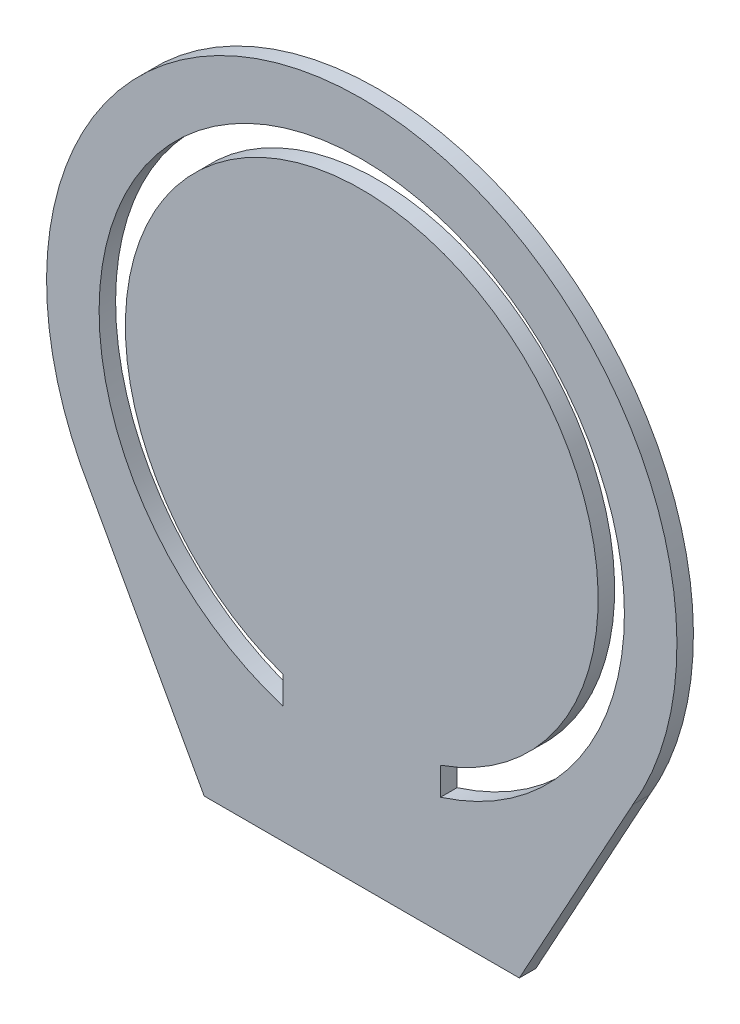
from build123d import *

# Parameters (mm, degrees)
ESBO_O1_R           = 30
ESBO_O1_R_2         = 25
BOSS_EXTRUDE1_DEPTH = 1.57
BOSS_EXTRUDE2_START = -1.57
BOSS_EXTRUDE2_DEPTH = 1.57
BOSS_EXTRUDE3_DEPTH = 1.57
BOSS_EXTRUDE4_START = -1.57
SKETCH4_R           = 22.5
BOSS_EXTRUDE4_DEPTH = 1.57


with BuildPart() as part:
    # Esboço1 → Boss-Extrude1 (new body)
    with BuildSketch(Plane.XY):
        Circle(ESBO_O1_R)
        Circle(ESBO_O1_R_2, mode=Mode.SUBTRACT)
    extrude(amount=BOSS_EXTRUDE1_DEPTH)

    # Sketch1 → Boss-Extrude2 (add)
    with BuildSketch(Plane.XY.offset(1.57).offset(BOSS_EXTRUDE2_START)):
        with BuildLine():
            Line((-25.800536663, -15.307916512), (-15, -35))
            Line((-15, -35), (-15, -25.980762114))
            ThreePointArc((-15, -25.980762114), (-21.086686707, -21.338970071), (-25.800536663, -15.307916512))
        make_face()
        with BuildLine():
            Line((-15, -35), (0, -35))
            Line((0, -35), (0, -30))
            ThreePointArc((0, -30), (-7.764571353, -28.977774789), (-15, -25.980762114))
            Line((-15, -25.980762114), (-15, -35))
        make_face()
        with BuildLine():
            Line((0, -35), (15, -35))
            Line((15, -35), (15, -25.980762114))
            ThreePointArc((15, -25.980762114), (7.764571353, -28.977774789), (0, -30))
            Line((0, -30), (0, -35))
        make_face()
        with BuildLine():
            Line((15, -25.980762114), (15, -35))
            Line((15, -35), (25.800536663, -15.307916512))
            ThreePointArc((25.800536663, -15.307916512), (21.086686707, -21.338970071), (15, -25.980762114))
        make_face()
    extrude(amount=BOSS_EXTRUDE2_DEPTH)

    # Sketch2 → Boss-Extrude3 (add)
    with BuildSketch(Plane.XY):
        with BuildLine():
            ThreePointArc((7.5, -21.213203436), (0, -22.5), (-7.5, -21.213203436))
            Line((-7.5, -21.213203436), (-7.5, -25))
            Line((-7.5, -25), (-2.5, -25))
            Line((-2.5, -25), (2.5, -25))
            Line((2.5, -25), (7.5, -25))
            Line((7.5, -25), (7.5, -21.213203436))
        make_face()
    extrude(amount=BOSS_EXTRUDE3_DEPTH)

    # Sketch4 → Boss-Extrude4 (add)
    with BuildSketch(Plane.XY.offset(1.57).offset(BOSS_EXTRUDE4_START)):
        Circle(SKETCH4_R)
    extrude(amount=BOSS_EXTRUDE4_DEPTH)


solid = part.part
